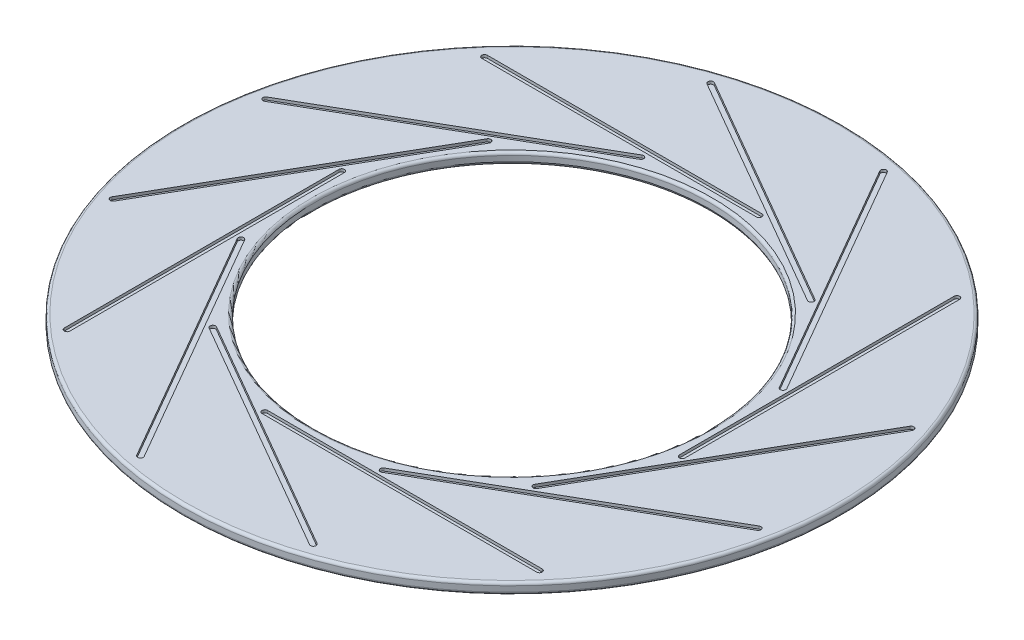
from build123d import *

# Parameters (mm, degrees)
SKETCH_1_R               = 60
SKETCH_1_R_2             = 36
EXTRUDE_1_DEPTH          = 1
CUT_EXTRUDE_1_DEPTH      = 0.5
PATTERN_CIRCULAR_1_COUNT = 12
FILLET_1_R               = 0.5


with BuildPart() as part:
    # Эскиз1 → Бобышка-Вытянуть1 (new, symmetric)
    with BuildSketch(Plane(origin=(0, 0, 0), x_dir=(1, 0, 0), z_dir=(0, 1, 0))):
        with Locations(Location((0, 0, 0), (0, 0, 270))):
            Circle(SKETCH_1_R)
        with Locations(Location((0, 0, 0), (0, 0, 270))):
            Circle(SKETCH_1_R_2, mode=Mode.SUBTRACT)
    extrude(amount=EXTRUDE_1_DEPTH, both=True)

    # Эскиз2 → Вырез-Вытянуть1 (cut)
    with BuildSketch(Plane(origin=(0, 1, 0), x_dir=(1, 0, 0), z_dir=(0, 1, 0))):
        with BuildLine():
            Line((7, 37.5), (-43, 37.5))
            ThreePointArc((-43, 37.5), (-43.5, 38), (-43, 38.5))
            Line((-43, 38.5), (7, 38.5))
            ThreePointArc((7, 38.5), (7.5, 38), (7, 37.5))
        make_face()
    cut_extrude_1 = extrude(amount=-CUT_EXTRUDE_1_DEPTH, mode=Mode.SUBTRACT)

    # Круговой массив1: Вырез-Вытянуть1 ×12 about axis
    pattern_circular_1_axis = Axis((0, 0, 0), (0, 1, 0))
    for i in range(1, PATTERN_CIRCULAR_1_COUNT):
        add(cut_extrude_1.rotate(pattern_circular_1_axis, i * 360 / PATTERN_CIRCULAR_1_COUNT), mode=Mode.SUBTRACT)

    # Скругление1
    fillet_1_edges = [part.edges().sort_by_distance(p)[0] for p in [
        (0, -1, -60),
        (0, 1, -60),
        (0, -1, -36),
        (0, 1, -36),
    ]]
    fillet(fillet_1_edges, radius=FILLET_1_R)


solid = part.part
